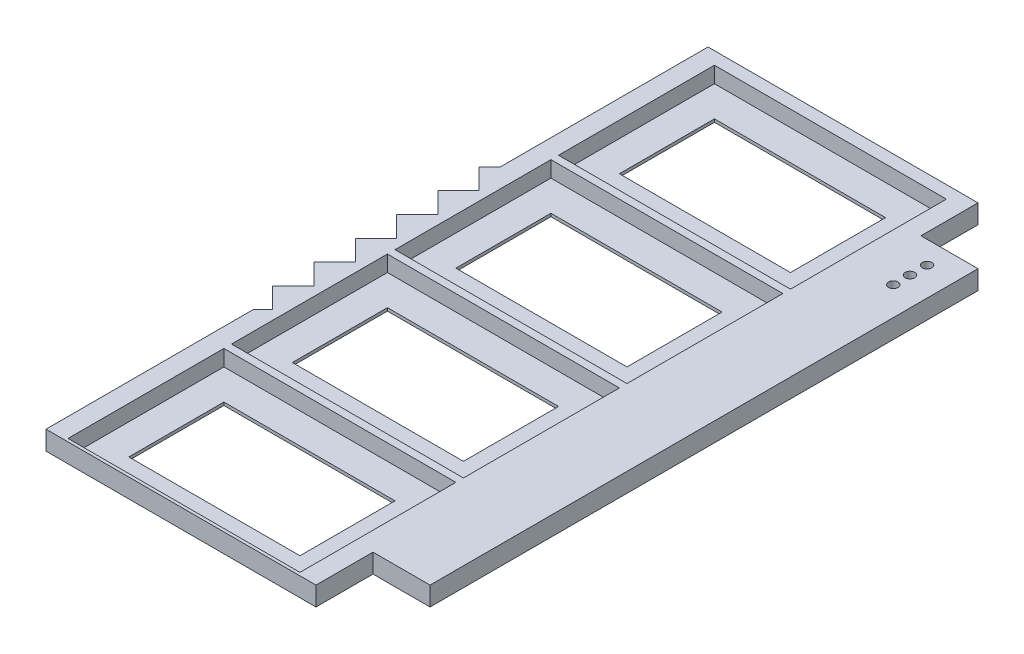
from build123d import *

# Parameters (mm, degrees)
SKETCH1_W           = 77.47
SKETCH1_H           = 52.07
SKETCH1_R           = 1.5875
SKETCH1_H_2         = 52.34
BOSS_EXTRUDE3_DEPTH = 6.35
SKETCH2_W           = 19.05
SKETCH2_H           = 1
CUT_EXTRUDE1_DEPTH  = 193.995155978
SKETCH4_W           = 19.05
SKETCH4_H           = 1
CUT_EXTRUDE2_DEPTH  = 193.995155978
SKETCH5_W           = 257.81
SKETCH5_H           = 1
BOSS_EXTRUDE4_DEPTH = 215.9
SKETCH6_W           = 57.15
SKETCH6_H           = 31.75
CUT_EXTRUDE3_DEPTH  = 193.964841955
CUT_EXTRUDE5_DEPTH  = 193.995155978


with BuildPart() as part:
    # Sketch1 → Boss-Extrude3 (new body)
    with BuildSketch(Plane(origin=(0, 0, 0), x_dir=(1, 0, 0), z_dir=(0, 1, 0))):
        Polygon((148.59, 94.11025641), (129.54, 94.11025641), (129.54, 113.16025641), (-137.02974359, 113.16025641), (-137.02974359, 93.98), (-156.21, 93.98), (-156.21, -88.9), (-137.16, -88.9), (-137.16, -106.95), (-156.21, -106.95), (-156.21, -107.95), (148.59, -107.95), (148.59, -106.95), (129.54, -106.95), (129.54, -88.9), (148.59, -88.9), align=None)
        with Locations((-95.885, -80.915)):
            Rectangle(SKETCH1_W, SKETCH1_H, mode=Mode.SUBTRACT)
        with Locations((-5.715, -80.915)):
            Rectangle(SKETCH1_W, SKETCH1_H, mode=Mode.SUBTRACT)
        with Locations((84.455, -80.915)):
            Rectangle(SKETCH1_W, SKETCH1_H, mode=Mode.SUBTRACT)
        with Locations((84.455, 82.915)):
            Rectangle(SKETCH1_W, SKETCH1_H, mode=Mode.SUBTRACT)
        with Locations((84.455, 28.305)):
            Rectangle(SKETCH1_W, SKETCH1_H, mode=Mode.SUBTRACT)
        with Locations((84.455, -26.305)):
            Rectangle(SKETCH1_W, SKETCH1_H, mode=Mode.SUBTRACT)
        with Locations(Location((139.065, 75.334869264, 0), (0, 0, 270))):
            Circle(SKETCH1_R, mode=Mode.SUBTRACT)
        with Locations(Location((139.065, 80.910552749, 0), (0, 0, 270))):
            Circle(SKETCH1_R, mode=Mode.SUBTRACT)
        with Locations(Location((139.065, 86.618990604, 0), (0, 0, 270))):
            Circle(SKETCH1_R, mode=Mode.SUBTRACT)
        with Locations((-5.715, 82.915)):
            Rectangle(SKETCH1_W, SKETCH1_H, mode=Mode.SUBTRACT)
        with Locations((-95.885, -26.305)):
            Rectangle(SKETCH1_W, SKETCH1_H, mode=Mode.SUBTRACT)
        with Locations((-5.715, -26.17)):
            Rectangle(SKETCH1_W, SKETCH1_H_2, mode=Mode.SUBTRACT)
        with Locations((-95.885, 28.305)):
            Rectangle(SKETCH1_W, SKETCH1_H, mode=Mode.SUBTRACT)
        with Locations((-5.715, 28.305)):
            Rectangle(SKETCH1_W, SKETCH1_H, mode=Mode.SUBTRACT)
        with Locations((-95.885, 82.915)):
            Rectangle(SKETCH1_W, SKETCH1_H, mode=Mode.SUBTRACT)
    extrude(amount=BOSS_EXTRUDE3_DEPTH)

    # Sketch2 → Cut-Extrude1 (cut, through all)
    with BuildSketch(Plane(origin=(0, 6.35, 0), x_dir=(1, 0, 0), z_dir=(0, 1, 0))):
        with Locations((139.065, -107.45)):
            Rectangle(SKETCH2_W, SKETCH2_H)
    extrude(amount=-CUT_EXTRUDE1_DEPTH, mode=Mode.SUBTRACT)

    # Sketch4 → Cut-Extrude2 (cut, through all)
    with BuildSketch(Plane(origin=(0, 6.35, 0), x_dir=(1, 0, 0), z_dir=(0, 1, 0))):
        with Locations((-146.685, -107.45)):
            Rectangle(SKETCH4_W, SKETCH4_H)
    extrude(amount=-CUT_EXTRUDE2_DEPTH, mode=Mode.SUBTRACT)

    # Sketch5 → Boss-Extrude4 (add)
    with BuildSketch(Plane.XY.offset(-108.95)):
        with Locations((-5.715, 0.5)):
            Rectangle(SKETCH5_W, SKETCH5_H)
    extrude(amount=BOSS_EXTRUDE4_DEPTH)

    # Sketch6 → Cut-Extrude3 (cut, through all)
    with BuildSketch(Plane(origin=(0, 1, 0), x_dir=(1, 0, 0), z_dir=(0, 1, 0))):
        with Locations((-95.885, 82.915)):
            Rectangle(SKETCH6_W, SKETCH6_H)
        with Locations((-95.885, 28.305)):
            Rectangle(SKETCH6_W, SKETCH6_H)
        with Locations((-95.885, -26.305)):
            Rectangle(SKETCH6_W, SKETCH6_H)
        with Locations((-95.885, -80.915)):
            Rectangle(SKETCH6_W, SKETCH6_H)
        with Locations((-5.715, 82.915)):
            Rectangle(SKETCH6_W, SKETCH6_H)
        with Locations((84.455, 82.915)):
            Rectangle(SKETCH6_W, SKETCH6_H)
        with Locations((-5.715, 28.305)):
            Rectangle(SKETCH6_W, SKETCH6_H)
        with Locations((-5.715, -26.305)):
            Rectangle(SKETCH6_W, SKETCH6_H)
        with Locations((-5.715, -80.915)):
            Rectangle(SKETCH6_W, SKETCH6_H)
        with Locations((84.455, -80.915)):
            Rectangle(SKETCH6_W, SKETCH6_H)
        with Locations((84.455, -26.305)):
            Rectangle(SKETCH6_W, SKETCH6_H)
        with Locations((84.455, 28.305)):
            Rectangle(SKETCH6_W, SKETCH6_H)
    extrude(amount=-CUT_EXTRUDE3_DEPTH, mode=Mode.SUBTRACT)

    # Sketch7 → Cut-Extrude5 (cut, through all)
    with BuildSketch(Plane(origin=(0, 6.35, 0), x_dir=(1, 0, 0), z_dir=(0, 1, 0))):
        Polygon((39.37, 43.846772262), (35.788770068, 40.26554233), (42.679389728, 33.37492267), (35.788770068, 26.48430301), (42.679389728, 19.593683351), (39.37, 16.284293623), (35.788770068, 12.703063691), (42.679389728, 5.812444031), (35.788770068, -1.078175628), (42.679389728, -7.968795288), (35.788770068, -14.859414948), (39.37, -18.44064488), (42.679389728, -21.750034608), (35.788770068, -28.640654267), (42.679389728, -35.531273927), (39.37, -38.840663655), (39.37, -107.95), (-160.951266418, -107.95), (-160.951266418, 113.16025641), (39.37, 113.16025641), align=None)
    extrude(amount=-CUT_EXTRUDE5_DEPTH, mode=Mode.SUBTRACT)


solid = part.part
